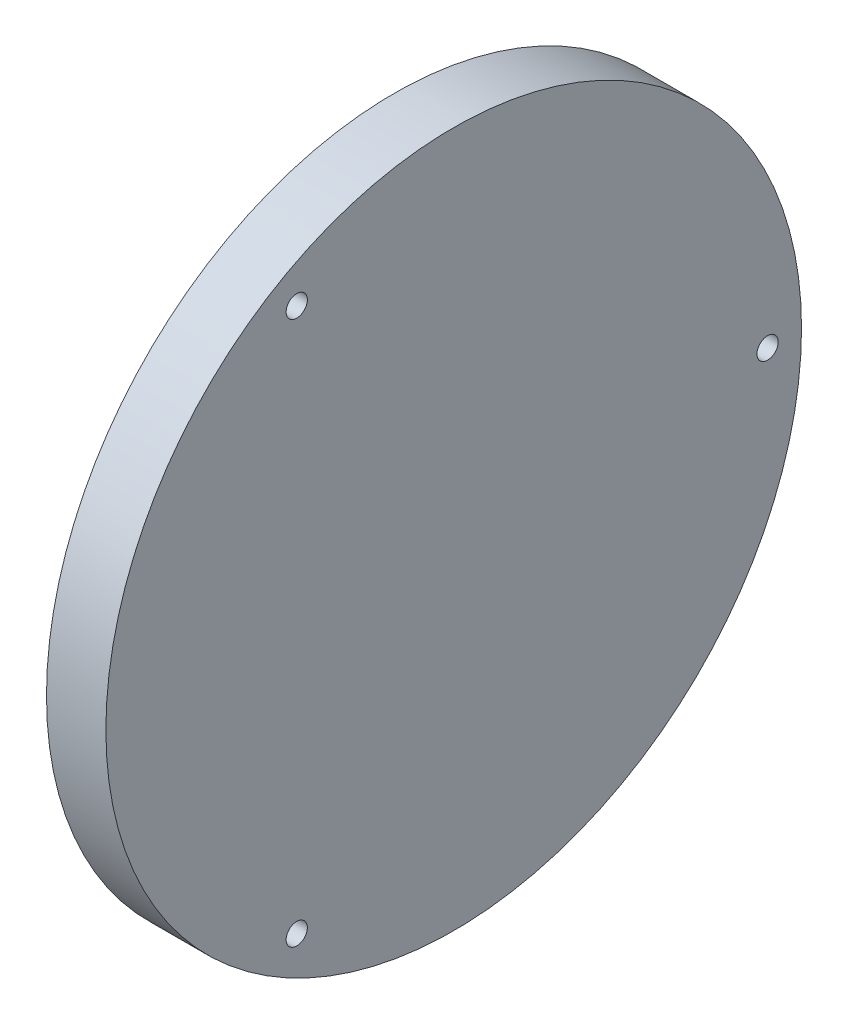
from build123d import *

# Parameters (mm, degrees)
SIX_INTEGRAL_DRY_MAGNET_WELL_ISLANDS_SKE_R     = 7.5
SIX_INTEGRAL_DRY_MAGNET_WELL_ISLANDS_DEPTH     = 4
INTEGRAL_6MM_WIDE_CHANNEL_DIVIDER_SKETCH_W     = 6
INTEGRAL_6MM_WIDE_CHANNEL_DIVIDER_SKETCH_H     = 21
INTEGRAL_6MM_WIDE_CHANNEL_DIVIDER_DEPTH        = 4
SEVEN_DRY_BLIND_MAGNET_WELLS_DEPTH4P5_SK_R     = 6.15
SEVEN_DRY_BLIND_MAGNET_WELLS_DEPTH4P5_SK_R_2   = 4.15
SEVEN_DRY_BLIND_MAGNET_WELLS_DEPTH4P5_DEPTH    = 4.5
CENTER_WELL_ID14X1P5_FACE_GLAND_SKETCH_R       = 8.75
CENTER_WELL_ID14X1P5_FACE_GLAND_SKETCH_R_2     = 6.75
CENTER_WELL_ID14X1P5_FACE_GLAND_DEPTH          = 1.15
OUTER_DRY_WELL_FACE_GLAND_1_SKETCH_R           = 6.75
OUTER_DRY_WELL_FACE_GLAND_1_SKETCH_R_2         = 4.75
OUTER_DRY_WELL_FACE_GLAND_1_DEPTH              = 1.15
OUTER_DRY_WELL_FACE_GLAND_2_SKETCH_R           = 6.75
OUTER_DRY_WELL_FACE_GLAND_2_SKETCH_R_2         = 4.75
OUTER_DRY_WELL_FACE_GLAND_2_DEPTH              = 1.15
OUTER_DRY_WELL_FACE_GLAND_3_SKETCH_R           = 6.75
OUTER_DRY_WELL_FACE_GLAND_3_SKETCH_R_2         = 4.75
OUTER_DRY_WELL_FACE_GLAND_3_DEPTH              = 1.15
OUTER_DRY_WELL_FACE_GLAND_4_SKETCH_R           = 6.75
OUTER_DRY_WELL_FACE_GLAND_4_SKETCH_R_2         = 4.75
OUTER_DRY_WELL_FACE_GLAND_4_DEPTH              = 1.15
OUTER_DRY_WELL_FACE_GLAND_5_SKETCH_R           = 6.75
OUTER_DRY_WELL_FACE_GLAND_5_SKETCH_R_2         = 4.75
OUTER_DRY_WELL_FACE_GLAND_5_DEPTH              = 1.15
OUTER_DRY_WELL_FACE_GLAND_6_SKETCH_R           = 6.75
OUTER_DRY_WELL_FACE_GLAND_6_SKETCH_R_2         = 4.75
OUTER_DRY_WELL_FACE_GLAND_6_DEPTH              = 1.15
PERIMETER_ID62X2_FACE_GLAND_SKETCH_R           = 33.3
PERIMETER_ID62X2_FACE_GLAND_SKETCH_R_2         = 30.7
PERIMETER_ID62X2_FACE_GLAND_DEPTH              = 1.5
SIX_REAR_M3_PILOT_POCKETS_PCD74_SKETCH_R       = 1.25
SIX_REAR_M3_PILOT_POCKETS_PCD74_DEPTH          = 4
THREE_START                                    = 4
THREE_INDEPENDENT_TARGET_CLAMP_PILOT_2_R       = 1.25
THREE_INDEPENDENT_TARGET_CLAMP_PILOTS_PC_DEPTH = 3


with BuildPart() as part:
    # Axial blank profile → Native revolved blank (revolve)
    with BuildSketch(Plane.XY, mode=Mode.PRIVATE) as native_revolved_blank_sk:
        Polygon((0, 0), (7, 0), (7, 41), (0, 41), (0, 29), (4, 29), (4, 10), (0, 10), align=None)
    revolve(native_revolved_blank_sk.sketch.rotate(Axis((-60, 0, 0), (1, 0, 0)), 90), axis=Axis((-60, 0, 0), (1, 0, 0)))

    # Six integral dry magnet-well islands sketch → Six integral dry magnet-well islands (add)
    with BuildSketch(Plane(origin=(0, 0, 0), x_dir=(0, 0, -1), z_dir=(1, 0, 0))):
        with Locations((0, 20)):
            Circle(SIX_INTEGRAL_DRY_MAGNET_WELL_ISLANDS_SKE_R)
        with Locations((-17.320508076, 10)):
            Circle(SIX_INTEGRAL_DRY_MAGNET_WELL_ISLANDS_SKE_R)
        with Locations((-17.320508076, -10)):
            Circle(SIX_INTEGRAL_DRY_MAGNET_WELL_ISLANDS_SKE_R)
        with Locations((0, -20)):
            Circle(SIX_INTEGRAL_DRY_MAGNET_WELL_ISLANDS_SKE_R)
        with Locations((17.320508076, -10)):
            Circle(SIX_INTEGRAL_DRY_MAGNET_WELL_ISLANDS_SKE_R)
        with Locations((17.320508076, 10)):
            Circle(SIX_INTEGRAL_DRY_MAGNET_WELL_ISLANDS_SKE_R)
    extrude(amount=SIX_INTEGRAL_DRY_MAGNET_WELL_ISLANDS_DEPTH)

    # Integral 6mm-wide channel divider sketch → Integral 6mm-wide channel divider (add)
    with BuildSketch(Plane(origin=(0, 0, 0), x_dir=(0, 0, -1), z_dir=(1, 0, 0))):
        with Locations((0, 19.5)):
            Rectangle(INTEGRAL_6MM_WIDE_CHANNEL_DIVIDER_SKETCH_W, INTEGRAL_6MM_WIDE_CHANNEL_DIVIDER_SKETCH_H)
    extrude(amount=INTEGRAL_6MM_WIDE_CHANNEL_DIVIDER_DEPTH)

    # Seven dry blind magnet wells depth4p5 sketch → Seven dry blind magnet wells depth4p5 (cut)
    with BuildSketch(Plane(origin=(0, 0, 0), x_dir=(0, 0, -1), z_dir=(1, 0, 0))):
        Circle(SEVEN_DRY_BLIND_MAGNET_WELLS_DEPTH4P5_SK_R)
        with Locations((0, 20)):
            Circle(SEVEN_DRY_BLIND_MAGNET_WELLS_DEPTH4P5_SK_R_2)
        with Locations((-17.320508076, 10)):
            Circle(SEVEN_DRY_BLIND_MAGNET_WELLS_DEPTH4P5_SK_R_2)
        with Locations((-17.320508076, -10)):
            Circle(SEVEN_DRY_BLIND_MAGNET_WELLS_DEPTH4P5_SK_R_2)
        with Locations((0, -20)):
            Circle(SEVEN_DRY_BLIND_MAGNET_WELLS_DEPTH4P5_SK_R_2)
        with Locations((17.320508076, -10)):
            Circle(SEVEN_DRY_BLIND_MAGNET_WELLS_DEPTH4P5_SK_R_2)
        with Locations((17.320508076, 10)):
            Circle(SEVEN_DRY_BLIND_MAGNET_WELLS_DEPTH4P5_SK_R_2)
    extrude(amount=SEVEN_DRY_BLIND_MAGNET_WELLS_DEPTH4P5_DEPTH, mode=Mode.SUBTRACT)

    # Center-well ID14x1p5 face gland sketch → Center-well ID14x1p5 face gland (cut)
    with BuildSketch(Plane(origin=(0, 0, 0), x_dir=(0, 0, -1), z_dir=(1, 0, 0))):
        Circle(CENTER_WELL_ID14X1P5_FACE_GLAND_SKETCH_R)
        Circle(CENTER_WELL_ID14X1P5_FACE_GLAND_SKETCH_R_2, mode=Mode.SUBTRACT)
    extrude(amount=CENTER_WELL_ID14X1P5_FACE_GLAND_DEPTH, mode=Mode.SUBTRACT)

    # Outer dry-well face gland 1 sketch → Outer dry-well face gland 1 (cut)
    with BuildSketch(Plane(origin=(0, 0, 0), x_dir=(0, 0, -1), z_dir=(1, 0, 0))):
        with Locations((0, 20)):
            Circle(OUTER_DRY_WELL_FACE_GLAND_1_SKETCH_R)
        with Locations((0, 20)):
            Circle(OUTER_DRY_WELL_FACE_GLAND_1_SKETCH_R_2, mode=Mode.SUBTRACT)
    extrude(amount=OUTER_DRY_WELL_FACE_GLAND_1_DEPTH, mode=Mode.SUBTRACT)

    # Outer dry-well face gland 2 sketch → Outer dry-well face gland 2 (cut)
    with BuildSketch(Plane(origin=(0, 0, 0), x_dir=(0, 0, -1), z_dir=(1, 0, 0))):
        with Locations((-17.320508076, 10)):
            Circle(OUTER_DRY_WELL_FACE_GLAND_2_SKETCH_R)
        with Locations((-17.320508076, 10)):
            Circle(OUTER_DRY_WELL_FACE_GLAND_2_SKETCH_R_2, mode=Mode.SUBTRACT)
    extrude(amount=OUTER_DRY_WELL_FACE_GLAND_2_DEPTH, mode=Mode.SUBTRACT)

    # Outer dry-well face gland 3 sketch → Outer dry-well face gland 3 (cut)
    with BuildSketch(Plane(origin=(0, 0, 0), x_dir=(0, 0, -1), z_dir=(1, 0, 0))):
        with Locations((-17.320508076, -10)):
            Circle(OUTER_DRY_WELL_FACE_GLAND_3_SKETCH_R)
        with Locations((-17.320508076, -10)):
            Circle(OUTER_DRY_WELL_FACE_GLAND_3_SKETCH_R_2, mode=Mode.SUBTRACT)
    extrude(amount=OUTER_DRY_WELL_FACE_GLAND_3_DEPTH, mode=Mode.SUBTRACT)

    # Outer dry-well face gland 4 sketch → Outer dry-well face gland 4 (cut)
    with BuildSketch(Plane(origin=(0, 0, 0), x_dir=(0, 0, -1), z_dir=(1, 0, 0))):
        with Locations((0, -20)):
            Circle(OUTER_DRY_WELL_FACE_GLAND_4_SKETCH_R)
        with Locations((0, -20)):
            Circle(OUTER_DRY_WELL_FACE_GLAND_4_SKETCH_R_2, mode=Mode.SUBTRACT)
    extrude(amount=OUTER_DRY_WELL_FACE_GLAND_4_DEPTH, mode=Mode.SUBTRACT)

    # Outer dry-well face gland 5 sketch → Outer dry-well face gland 5 (cut)
    with BuildSketch(Plane(origin=(0, 0, 0), x_dir=(0, 0, -1), z_dir=(1, 0, 0))):
        with Locations((17.320508076, -10)):
            Circle(OUTER_DRY_WELL_FACE_GLAND_5_SKETCH_R)
        with Locations((17.320508076, -10)):
            Circle(OUTER_DRY_WELL_FACE_GLAND_5_SKETCH_R_2, mode=Mode.SUBTRACT)
    extrude(amount=OUTER_DRY_WELL_FACE_GLAND_5_DEPTH, mode=Mode.SUBTRACT)

    # Outer dry-well face gland 6 sketch → Outer dry-well face gland 6 (cut)
    with BuildSketch(Plane(origin=(0, 0, 0), x_dir=(0, 0, -1), z_dir=(1, 0, 0))):
        with Locations((17.320508076, 10)):
            Circle(OUTER_DRY_WELL_FACE_GLAND_6_SKETCH_R)
        with Locations((17.320508076, 10)):
            Circle(OUTER_DRY_WELL_FACE_GLAND_6_SKETCH_R_2, mode=Mode.SUBTRACT)
    extrude(amount=OUTER_DRY_WELL_FACE_GLAND_6_DEPTH, mode=Mode.SUBTRACT)

    # Perimeter ID62x2 face gland sketch → Perimeter ID62x2 face gland (cut)
    with BuildSketch(Plane(origin=(0, 0, 0), x_dir=(0, 0, -1), z_dir=(1, 0, 0))):
        Circle(PERIMETER_ID62X2_FACE_GLAND_SKETCH_R)
        Circle(PERIMETER_ID62X2_FACE_GLAND_SKETCH_R_2, mode=Mode.SUBTRACT)
    extrude(amount=PERIMETER_ID62X2_FACE_GLAND_DEPTH, mode=Mode.SUBTRACT)

    # Six rear M3 pilot pockets PCD74 sketch → Six rear M3 pilot pockets PCD74 (cut)
    with BuildSketch(Plane(origin=(0, 0, 0), x_dir=(0, 0, -1), z_dir=(1, 0, 0))):
        with Locations((0, 37)):
            Circle(SIX_REAR_M3_PILOT_POCKETS_PCD74_SKETCH_R)
        with Locations((-32.04293994, 18.5)):
            Circle(SIX_REAR_M3_PILOT_POCKETS_PCD74_SKETCH_R)
        with Locations((-32.04293994, -18.5)):
            Circle(SIX_REAR_M3_PILOT_POCKETS_PCD74_SKETCH_R)
        with Locations((0, -37)):
            Circle(SIX_REAR_M3_PILOT_POCKETS_PCD74_SKETCH_R)
        with Locations((32.04293994, -18.5)):
            Circle(SIX_REAR_M3_PILOT_POCKETS_PCD74_SKETCH_R)
        with Locations((32.04293994, 18.5)):
            Circle(SIX_REAR_M3_PILOT_POCKETS_PCD74_SKETCH_R)
    extrude(amount=SIX_REAR_M3_PILOT_POCKETS_PCD74_DEPTH, mode=Mode.SUBTRACT)

    # Three independent target-clamp pilot 2 → Three independent target-clamp pilots PC (cut)
    with BuildSketch(Plane(origin=(0, 0, 0), x_dir=(0, 0, -1), z_dir=(1, 0, 0)).offset(THREE_START)):
        with Locations((-18.5, 32.04293994)):
            Circle(THREE_INDEPENDENT_TARGET_CLAMP_PILOT_2_R)
        with Locations((-18.5, -32.04293994)):
            Circle(THREE_INDEPENDENT_TARGET_CLAMP_PILOT_2_R)
        with Locations((37, 0)):
            Circle(THREE_INDEPENDENT_TARGET_CLAMP_PILOT_2_R)
    extrude(amount=THREE_INDEPENDENT_TARGET_CLAMP_PILOTS_PC_DEPTH, mode=Mode.SUBTRACT)


solid = part.part
